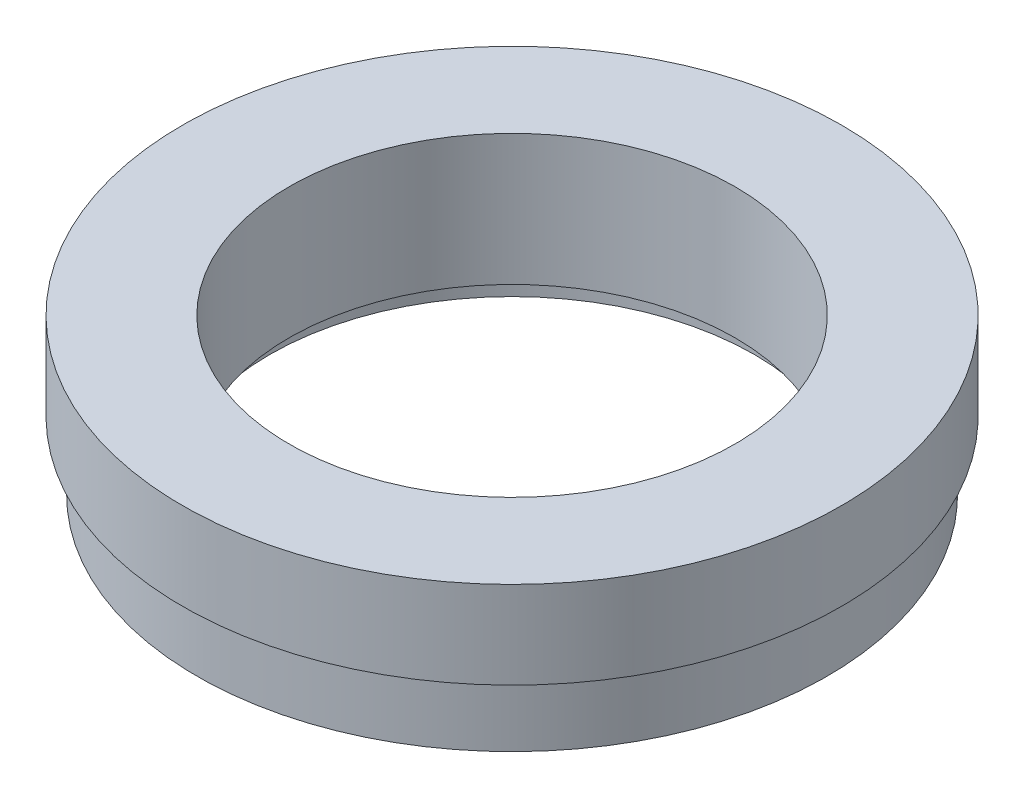
from build123d import *


with BuildPart() as part:
    # Sketch2 → Revolve1 (revolve)
    with BuildSketch(Plane.XY, mode=Mode.PRIVATE) as revolve1_sk:
        Polygon((23, 2.5), (23, 16), (34, 16), (34, 7), (32.5, 7), (32.5, 0), (25, 0), (25, 2.5), align=None)
    revolve(revolve1_sk.sketch.rotate(Axis((0, 0, 0), (0, 1, 0)), 90), axis=Axis((0, 0, 0), (0, 1, 0)))


solid = part.part
